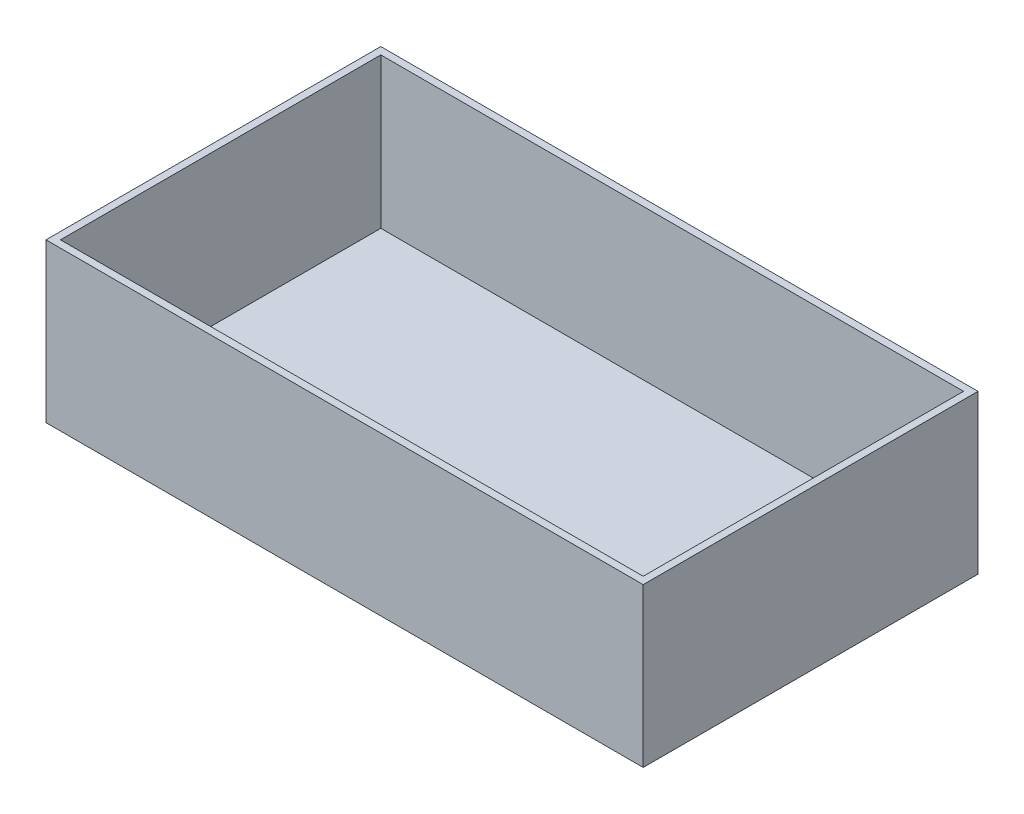
from build123d import *

# Parameters (mm, degrees)
CROQUIS1_W              = 1320
CROQUIS1_H              = 740
SALIENTE_EXTRUIR1_DEPTH = 350
CROQUIS2_W              = 1288
CROQUIS2_H              = 708
CORTAR_EXTRUIR1_DEPTH   = 332


with BuildPart() as part:
    # Croquis1 → Saliente-Extruir1 (new body)
    with BuildSketch(Plane(origin=(0, 0, 0), x_dir=(1, 0, 0), z_dir=(0, 1, 0))):
        Rectangle(CROQUIS1_W, CROQUIS1_H)
    extrude(amount=SALIENTE_EXTRUIR1_DEPTH)

    # Croquis2 → Cortar-Extruir1 (cut)
    with BuildSketch(Plane(origin=(0, 350, 0), x_dir=(1, 0, 0), z_dir=(0, 1, 0))):
        Rectangle(CROQUIS2_W, CROQUIS2_H)
    extrude(amount=-CORTAR_EXTRUIR1_DEPTH, mode=Mode.SUBTRACT)


solid = part.part
